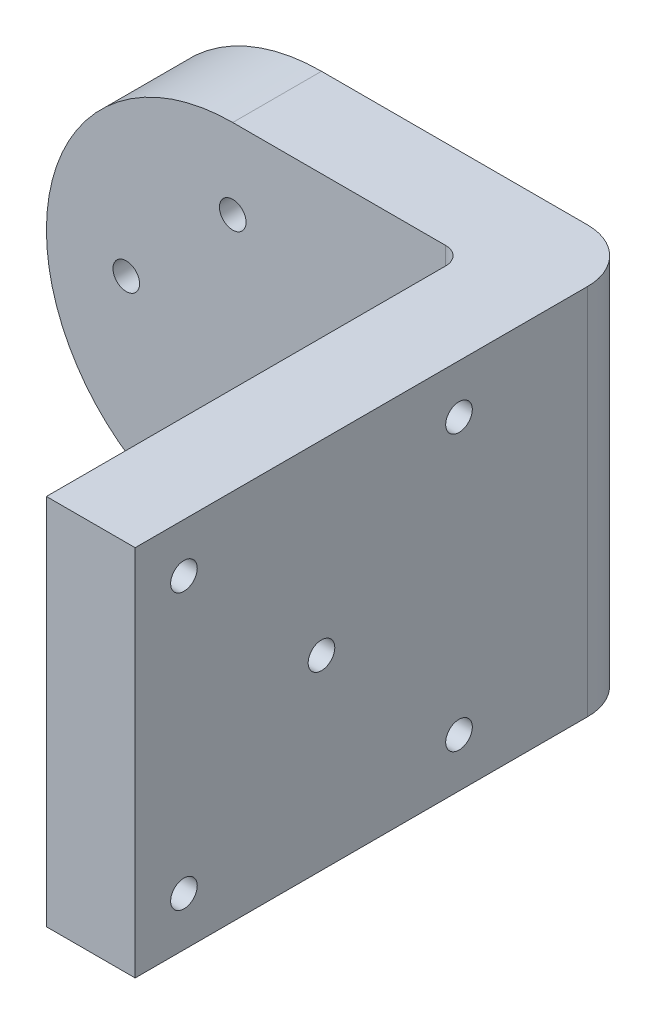
from build123d import *

# Parameters (mm, degrees)
SKETCH_1_W      = 5
SKETCH_1_H      = 42
EXTRUDE_1_DEPTH = 10
SKETCH_2_W      = 57
SKETCH_2_H      = 42
SKETCH_2_R      = 1.5
EXTRUDE_2_DEPTH = 10
FILLET_1_R      = 2
FILLET_2_R      = 6


with BuildPart() as part:
    # 草图1 → 凸台-拉伸1 (new body)
    with BuildSketch(Plane.XY):
        with BuildLine():
            Line((0, 13.5), (0, 21))
            ThreePointArc((0, 21), (-21, 0), (0, -21))
            Line((0, -21), (0, -13.5))
            ThreePointArc((0, -13.5), (-1.09330348, -13.026979795), (-1.497067446, -11.90625))
            ThreePointArc((-1.497067446, -11.90625), (-8.485281374, -8.485281374), (-11.90625, -1.497067446))
            ThreePointArc((-11.90625, -1.497067446), (-13.5, 0), (-11.90625, 1.497067446))
            ThreePointArc((-11.90625, 1.497067446), (-8.485281374, 8.485281374), (-1.497067446, 11.90625))
            ThreePointArc((-1.497067446, 11.90625), (-1.09330348, 13.026979795), (0, 13.5))
        make_face()
        with BuildLine():
            ThreePointArc((21, 0), (14.849242405, 14.849242405), (0, 21))
            Line((0, 21), (0, 13.5))
            ThreePointArc((0, 13.5), (1.060660172, 13.060660172), (1.5, 12))
            ThreePointArc((1.5, 12), (1.499266682, 11.953102073), (1.497067446, 11.90625))
            ThreePointArc((1.497067446, 11.90625), (8.485281374, 8.485281374), (11.90625, 1.497067446))
            ThreePointArc((11.90625, 1.497067446), (13.026979795, 1.09330348), (13.5, 0))
            ThreePointArc((13.5, 0), (13.026979795, -1.09330348), (11.90625, -1.497067446))
            ThreePointArc((11.90625, -1.497067446), (8.485281374, -8.485281374), (1.497067446, -11.90625))
            ThreePointArc((1.497067446, -11.90625), (1.499266682, -11.953102073), (1.5, -12))
            ThreePointArc((1.5, -12), (1.060660172, -13.060660172), (0, -13.5))
            Line((0, -13.5), (0, -21))
            ThreePointArc((0, -21), (14.849242405, -14.849242405), (21, 0))
        make_face()
        with BuildLine():
            ThreePointArc((0, 10.5), (-1.026979795, 10.90669652), (-1.497067446, 11.90625))
            ThreePointArc((-1.497067446, 11.90625), (-8.485281374, 8.485281374), (-11.90625, 1.497067446))
            ThreePointArc((-11.90625, 1.497067446), (-10.90669652, 1.026979795), (-10.5, 0))
            ThreePointArc((-10.5, 0), (-10.90669652, -1.026979795), (-11.90625, -1.497067446))
            ThreePointArc((-11.90625, -1.497067446), (-8.485281374, -8.485281374), (-1.497067446, -11.90625))
            ThreePointArc((-1.497067446, -11.90625), (-1.026979795, -10.90669652), (0, -10.5))
            Line((0, -10.5), (0, 10.5))
        make_face()
        with BuildLine():
            ThreePointArc((1.497067446, 11.90625), (1.026979795, 10.90669652), (0, 10.5))
            Line((0, 10.5), (0, -10.5))
            ThreePointArc((0, -10.5), (1.026979795, -10.90669652), (1.497067446, -11.90625))
            ThreePointArc((1.497067446, -11.90625), (8.485281374, -8.485281374), (11.90625, -1.497067446))
            ThreePointArc((11.90625, -1.497067446), (10.5, 0), (11.90625, 1.497067446))
            ThreePointArc((11.90625, 1.497067446), (8.485281374, 8.485281374), (1.497067446, 11.90625))
        make_face()
        with BuildLine():
            Line((21, 21), (0, 21))
            ThreePointArc((0, 21), (14.849242405, 14.849242405), (21, 0))
            Line((21, 0), (21, 21))
        make_face()
        with Locations((23.5, 0)):
            Rectangle(SKETCH_1_W, SKETCH_1_H)
        Polygon((26, 21), (21, 21), (21, 0), (21, -21), (26, -21), align=None)
        with BuildLine():
            Line((21, -21), (21, 0))
            ThreePointArc((21, 0), (14.849242405, -14.849242405), (0, -21))
            Line((0, -21), (21, -21))
        make_face()
    extrude(amount=EXTRUDE_1_DEPTH)

    # 草图2 → 凸台-拉伸2 (add)
    with BuildSketch(Plane(origin=(26, 0, 0), x_dir=(0, 0, -1), z_dir=(1, 0, 0))):
        with Locations((-28.5, 0)):
            Rectangle(SKETCH_2_W, SKETCH_2_H)
        with Locations((-51.5, 15.5)):
            Circle(SKETCH_2_R, mode=Mode.SUBTRACT)
        with Locations((-36, 0)):
            Circle(SKETCH_2_R, mode=Mode.SUBTRACT)
        with Locations((-51.5, -15.5)):
            Circle(SKETCH_2_R, mode=Mode.SUBTRACT)
        with Locations((-20.5, -15.5)):
            Circle(SKETCH_2_R, mode=Mode.SUBTRACT)
        with Locations((-20.5, 15.5)):
            Circle(SKETCH_2_R, mode=Mode.SUBTRACT)
    extrude(amount=EXTRUDE_2_DEPTH)

    # 圆角1
    fillet_1_edges = [part.edges().sort_by_distance(p)[0] for p in [
        (26, 0, 10),
    ]]
    fillet(fillet_1_edges, radius=FILLET_1_R)

    # 圆角2
    fillet_2_edges = [part.edges().sort_by_distance(p)[0] for p in [
        (36, 0, 0),
    ]]
    fillet(fillet_2_edges, radius=FILLET_2_R)


solid = part.part
